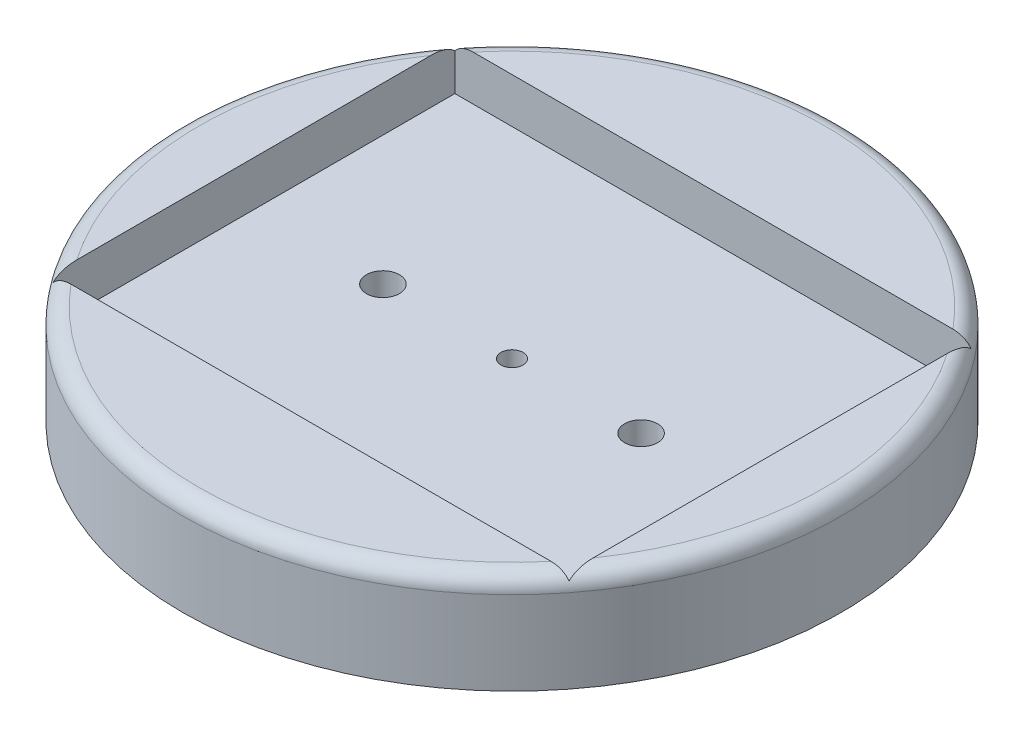
from build123d import *

# Parameters (mm, degrees)
SKETCH1_R           = 30
BOSS_EXTRUDE1_DEPTH = 9.1
FILLET1_R           = 1.5
SKETCH2_W           = 47
SKETCH2_H           = 36.6
CUT_EXTRUDE1_DEPTH  = 4.1
SKETCH3_R           = 1.5
CUT_EXTRUDE2_DEPTH  = 43.720018867
CUT_EXTRUDE3_DEPTH  = 3
SKETCH5_R           = 1
CUT_EXTRUDE4_DEPTH  = 43.862687891


with BuildPart() as part:
    # Sketch1 → Boss-Extrude1 (new body)
    with BuildSketch(Plane(origin=(0, 0, 0), x_dir=(1, 0, 0), z_dir=(0, 1, 0))):
        with Locations(Location((0, 0, 0), (0, 0, 270))):
            Circle(SKETCH1_R)
    extrude(amount=BOSS_EXTRUDE1_DEPTH)

    # Fillet1
    fillet1_edges = [part.edges().sort_by_distance(p)[0] for p in [
        (0, 9.1, -30),
    ]]
    fillet(fillet1_edges, radius=FILLET1_R)

    # Sketch2 → Cut-Extrude1 (cut)
    with BuildSketch(Plane(origin=(0, 9.1, 0), x_dir=(1, 0, 0), z_dir=(0, 1, 0))):
        Rectangle(SKETCH2_W, SKETCH2_H)
    extrude(amount=-CUT_EXTRUDE1_DEPTH, mode=Mode.SUBTRACT)

    # Sketch3 → Cut-Extrude2 (cut, through all)
    with BuildSketch(Plane(origin=(0, 5, 0), x_dir=(1, 0, 0), z_dir=(0, 1, 0))):
        with Locations(Location((11.75, 0, 0), (0, 0, 270))):
            Circle(SKETCH3_R)
        with Locations(Location((-11.75, 0, 0), (0, 0, 90))):
            Circle(SKETCH3_R)
    extrude(amount=-CUT_EXTRUDE2_DEPTH, mode=Mode.SUBTRACT)

    # Sketch4 → Cut-Extrude3 (cut)
    with BuildSketch(Plane.XZ):
        with BuildLine():
            Line((-2.389129319, 14.428169014), (-3.73301456, 0.356514085))
            ThreePointArc((-3.73301456, 0.356514085), (-3.75, 0), (-3.73301456, -0.356514085))
            Line((-3.73301456, -0.356514085), (-2.389129319, -14.428169014))
            ThreePointArc((-2.389129319, -14.428169014), (0, -16.6), (2.389129319, -14.428169014))
            Line((2.389129319, -14.428169014), (3.73301456, -0.356514085))
            ThreePointArc((3.73301456, -0.356514085), (3.75, 0), (3.73301456, 0.356514085))
            Line((3.73301456, 0.356514085), (2.389129319, 14.428169014))
            ThreePointArc((2.389129319, 14.428169014), (0, 16.6), (-2.389129319, 14.428169014))
        make_face()
    extrude(amount=-CUT_EXTRUDE3_DEPTH, mode=Mode.SUBTRACT)

    # Sketch5 → Cut-Extrude4 (cut, through all)
    with BuildSketch(Plane.XZ.offset(-3)):
        with Locations(Location((0, 0, 0), (0, 0, 270))):
            Circle(SKETCH5_R)
    extrude(amount=-CUT_EXTRUDE4_DEPTH, mode=Mode.SUBTRACT)


solid = part.part
